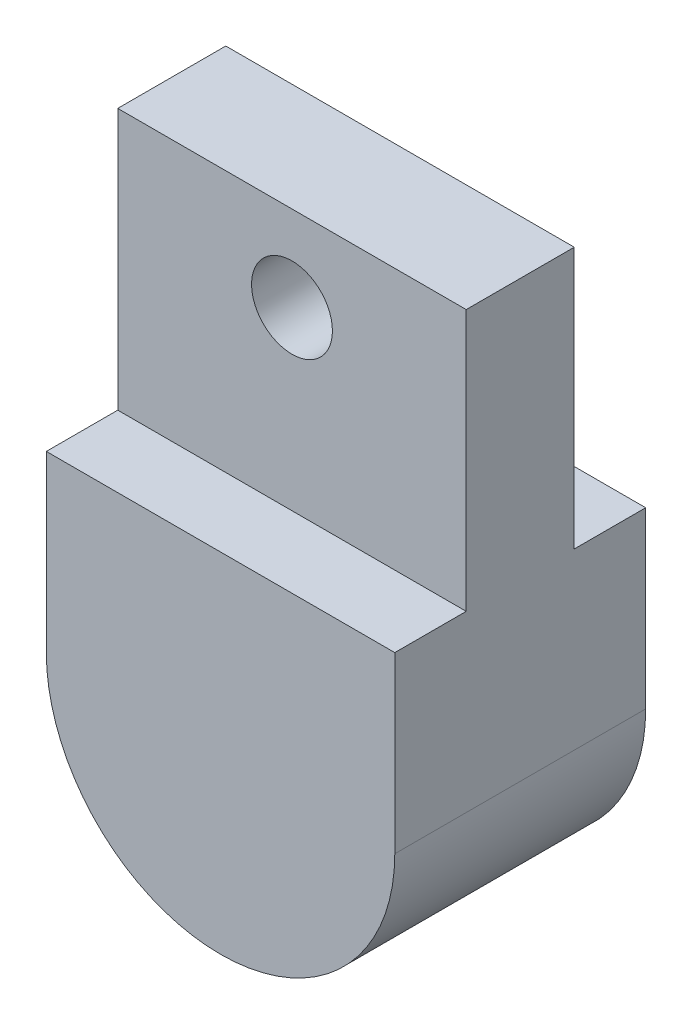
from build123d import *

# Parameters (mm, degrees)
SKETCH1_W             = 12.7
SKETCH1_H             = 3.937
BOSS_EXTRUDE1_DEPTH   = 9.525
F_4_CLEARANCE_HOLE1_D = 2.9464
BOSS_EXTRUDE3_DEPTH   = 9.144


with BuildPart() as part:
    # Sketch1 → Boss-Extrude1 (new body)
    with BuildSketch(Plane(origin=(0, 0, 0), x_dir=(1, 0, 0), z_dir=(0, 1, 0))):
        Rectangle(SKETCH1_W, SKETCH1_H)
    extrude(amount=-BOSS_EXTRUDE1_DEPTH)

    # #4 Clearance Hole1 (through all)
    with Locations(Plane.XY.offset(1.9685)):
        with Locations((0, -3.1115)):
            Hole(F_4_CLEARANCE_HOLE1_D / 2)

    # Sketch8 → Boss-Extrude3 (add)
    with BuildSketch(Plane(origin=(-1.778, 0, 4.572), x_dir=(-1, 0, 0), z_dir=(0, 0, -1))):
        with BuildLine():
            Line((4.572, -15.875), (4.572, -9.525))
            Line((4.572, -9.525), (-8.128, -9.525))
            Line((-8.128, -9.525), (-8.128, -15.875))
            ThreePointArc((-8.128, -15.875), (-1.778, -22.225), (4.572, -15.875))
        make_face()
    extrude(amount=BOSS_EXTRUDE3_DEPTH)


solid = part.part
